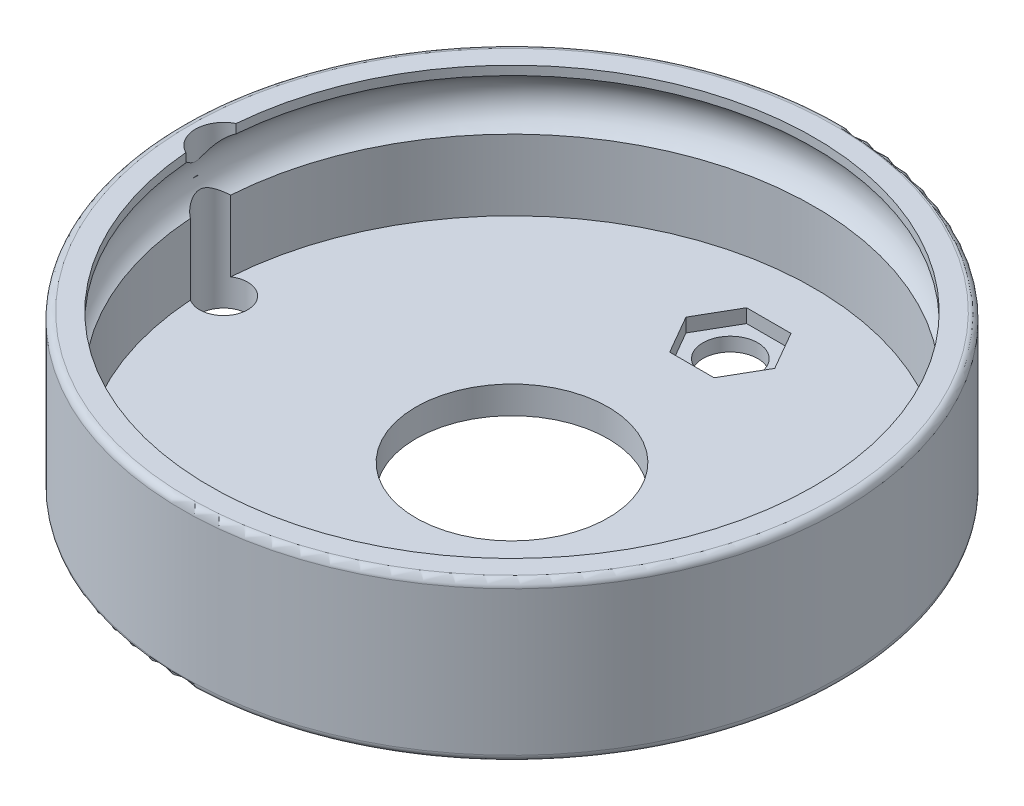
from build123d import *

# Parameters (mm, degrees)
FILLET_1_R               = 0.5
SKETCH_11_R              = 2.05
CUT_EXTRUDE_3_DEPTH      = 3
CUT_EXTRUDE_6_DEPTH      = 6
CUT_EXTRUDE_6_DEPTH_BACK = 36.24556726
SKETCH_13_R              = 1.75
CUT_EXTRUDE_7_DEPTH      = 1
SKETCH_16_R              = 2
CUT_EXTRUDE_8_DEPTH      = 1


with BuildPart() as part:
    # 草图2 → 旋转1 (revolve)
    with BuildSketch(Plane.XY, mode=Mode.PRIVATE) as revolve_1_sk:
        with BuildLine():
            Line((7, 2), (7, 0))
            Line((7, 0), (24, 0))
            Line((24, 0), (24, 11.5))
            Line((24, 11.5), (22, 11.5))
            Line((22, 11.5), (22, 10.846618531))
            ThreePointArc((22, 10.846618531), (22.804161855, 10.074709263), (23.1, 9))
            ThreePointArc((23.1, 9), (22.804161855, 7.925290737), (22, 7.153381469))
            Line((22, 7.153381469), (22, 2))
            Line((22, 2), (7, 2))
        make_face()
    revolve(revolve_1_sk.sketch.rotate(Axis((0, 2, 0), (0, -1, 0)), 180), axis=Axis((0, 2, 0), (0, -1, 0)))

    # 圆角1
    fillet_1_edges = [part.edges().sort_by_distance(p)[0] for p in [
        (24, 11.5, 0),
        (24, 0, 0),
    ]]
    fillet(fillet_1_edges, radius=FILLET_1_R)

    # 草图11 → 切除-拉伸3 (cut)
    with BuildSketch(Plane(origin=(0, 11.5, 0), x_dir=(1, 0, 0), z_dir=(0, 1, 0))):
        with Locations((-21, 0)):
            Circle(SKETCH_11_R)
    extrude(amount=-CUT_EXTRUDE_3_DEPTH, mode=Mode.SUBTRACT)

    # 草图13 → 切除-拉伸6 (cut, two sides: drawn at the far end of the back side and taken through both)
    with BuildSketch(Plane(origin=(0, 2, 0), x_dir=(1, 0, 0), z_dir=(0, 1, 0)).offset(-CUT_EXTRUDE_6_DEPTH_BACK)):
        with Locations(Location((-21, 0, 0), (0, 0, 122.913164288))):
            Circle(SKETCH_13_R)
    extrude(amount=CUT_EXTRUDE_6_DEPTH + CUT_EXTRUDE_6_DEPTH_BACK, mode=Mode.SUBTRACT)

    # 草图15 → 切除-拉伸7 (cut)
    with BuildSketch(Plane(origin=(0, 2, 0), x_dir=(1, 0, 0), z_dir=(0, 1, 0))):
        Polygon((-2.833161507, 15.5), (-1.216580754, 18.3), (2.016580754, 18.3), (3.633161507, 15.5), (2.016580754, 12.7), (-1.216580754, 12.7), align=None)
        Polygon((2.016580754, -12.7), (-1.216580754, -12.7), (-2.833161507, -15.5), (-1.216580754, -18.3), (2.016580754, -18.3), (3.633161507, -15.5), align=None)
    extrude(amount=-CUT_EXTRUDE_7_DEPTH, mode=Mode.SUBTRACT)

    # 草图16 → 切除-拉伸8 (cut)
    with BuildSketch(Plane(origin=(0, 1, 0), x_dir=(1, 0, 0), z_dir=(0, 1, 0))):
        with Locations(Location((0.4, 15.5, 0), (0, 0, 270))):
            Circle(SKETCH_16_R)
        with Locations(Location((0.4, -15.5, 0), (0, 0, 270))):
            Circle(SKETCH_16_R)
    extrude(amount=-CUT_EXTRUDE_8_DEPTH, mode=Mode.SUBTRACT)


solid = part.part
